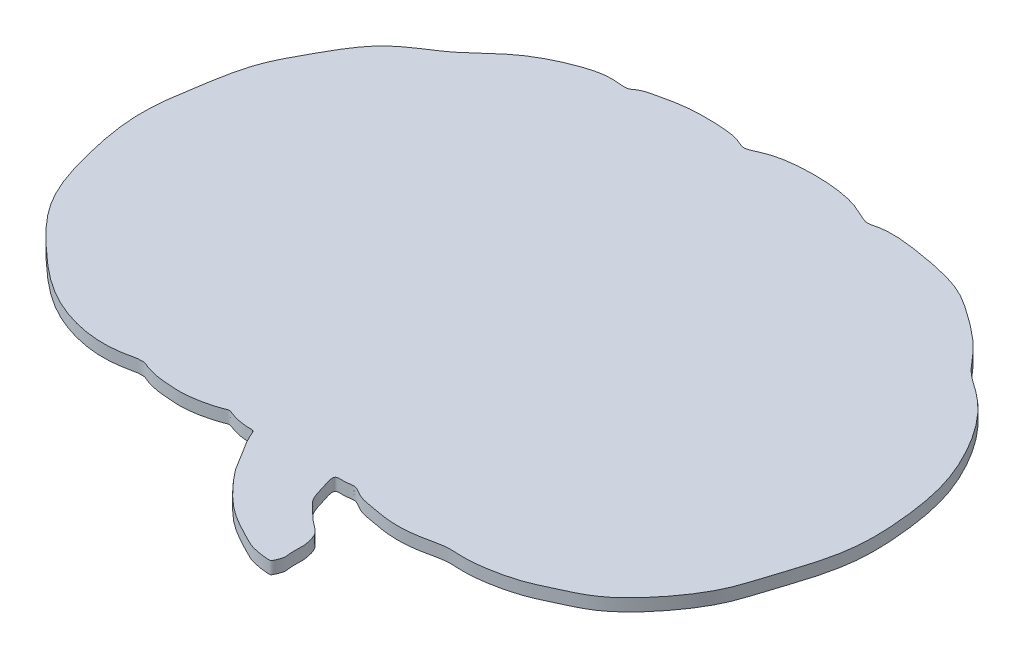
from build123d import *

# Parameters (mm, degrees)
SKETCH2_W           = 100
SKETCH2_H           = 100
BOSS_EXTRUDE1_DEPTH = 1.6
SKETCH3_OUTSIDE_W   = 130.286
SKETCH3_OUTSIDE_H   = 130.286
CUT_EXTRUDE1_DEPTH  = 1.6


with BuildPart() as part:
    # Sketch2 → Boss-Extrude1 (new body)
    with BuildSketch(Plane(origin=(0, 0, 0), x_dir=(1, 0, 0), z_dir=(0, 1, 0))):
        with Locations((-0.257731959, 18.943298969)):
            Rectangle(SKETCH2_W, SKETCH2_H)
    extrude(amount=-BOSS_EXTRUDE1_DEPTH)

    # Sketch3 outside → Cut-Extrude1 (cut)
    with BuildSketch(Plane(origin=(0, 0, 0), x_dir=(1, 0, 0), z_dir=(0, 1, 0))):
        with Locations((-0.258, 18.943)):
            Rectangle(SKETCH3_OUTSIDE_W, SKETCH3_OUTSIDE_H)
        with BuildLine():
            add(Edge.make_bspline(
                [(34.950997309, 45.362695625), (34.164831879, 46.178078321), (33.054937022, 47.967635676), (27.153917513, 52.406842473), (23.618279455, 54.24527127), (12.853472068, 56.049963087), (12.246934354, 54.364788685), (8.863222055, 56.557906971), (3.232160225, 57.229013924), (-2.157342772, 56.733671872), (-4.743426049, 55.034573484), (-5.812529736, 56.321241282), (-12.529283693, 56.565433617), (-14.901100597, 55.970851265), (-18.098005708, 55.302503425), (-18.610656154, 54.240448528), (-21.57387673, 55.146611767), (-27.301190872, 52.940548745), (-30.530434878, 50.832897231), (-33.852761058, 47.571927081), (-36.499264877, 45.839040885), (-40.287753693, 43.366865412), (-42.900938577, 38.608638109), (-45.937250479, 33.148799795), (-46.867439613, 27.220903425), (-48.046245103, 20.122367554), (-46.657550346, 12.471424796), (-44.156406564, 4.429669919), (-38.463388654, -1.289500535), (-31.892073125, -6.895358131), (-24.719390994, -8.610805623), (-20.544747565, -7.490478672), (-19.227418166, -7.446080787), (-19.270316446, -7.615797929), (-17.157434198, -8.249912673), (-14.515770266, -8.441024866), (-13.814628363, -8.49930702), (-11.848765158, -8.327082288), (-8.863747698, -7.583120649), (-8.63195569, -7.213031625), (-7.944967491, -7.552904389), (-7.227597251, -7.752341829), (-6.789606886, -7.880850065), (-5.268034144, -8.140151172), (-4.609625604, -7.88886944), (-4.29045862, -9.032726702), (-3.376811968, -10.544082426), (-2.660167345, -11.577393306), (-1.899268674, -13.208266223), (0.639121853, -16.221702105), (3.443338573, -18.766640075), (7.146851366, -20.620150121), (8.330947943, -21.330628058), (11.012209874, -21.626050336), (11.129229985, -21.457948699), (11.658160639, -20.27817926), (11.43720061, -19.551823763), (11.513454219, -17.906831656), (11.478056077, -17.508654259), (11.096070688, -15.48145802), (9.487267171, -14.592017914), (8.252373867, -13.257342574), (6.883291984, -12.159603408), (6.372702035, -10.491863326), (5.974551747, -9.363855541), (5.596278177, -7.850901786), (6.629517545, -7.890663318), (7.293566406, -7.878060994), (8.411562066, -7.613889334), (9.589380867, -8.653579819), (11.558799121, -8.915535728), (13.790322917, -9.408802563), (16.293471961, -9.465985035), (18.726890247, -9.082478047), (20.917712941, -8.511473013), (23.470944093, -8.77858095), (26.540958376, -8.394619581), (29.827797246, -7.604785039), (32.85115181, -6.118726522), (36.086084334, -4.702133218), (38.9006861, -2.173439828), (41.613648052, 1.152126904), (43.839095788, 4.723689829), (44.995395496, 8.784747337), (46.449572903, 12.985339864), (47.700686586, 18.16111214), (47.384180112, 24.444104281), (46.358082644, 30.669995162), (43.428316608, 37.129025351), (39.572142658, 42.257042456), (35.896545865, 44.382006445), (34.950997309, 45.362695625)],
                knots=[0, 0, 0, 0, 0.012581439, 0.021851406, 0.030192451, 0.03745538, 0.048803808, 0.056374421, 0.06415912, 0.072450955, 0.078983456, 0.085348182, 0.092327958, 0.100034412, 0.101849472, 0.110478557, 0.123680031, 0.143068749, 0.164045513, 0.177916208, 0.185937091, 0.20134871, 0.227824806, 0.246133936, 0.271974478, 0.295025885, 0.327362492, 0.359184618, 0.388613558, 0.416913063, 0.457724704, 0.463497906, 0.465472855, 0.471845881, 0.477112479, 0.480366301, 0.488424722, 0.493818067, 0.498708146, 0.507262607, 0.510940013, 0.513494469, 0.515545522, 0.518533956, 0.522910129, 0.528108255, 0.53218391, 0.537728085, 0.543638758, 0.560426517, 0.576701386, 0.589340543, 0.602104403, 0.605118156, 0.607694702, 0.61019699, 0.613016072, 0.616872562, 0.621645706, 0.628107162, 0.635128646, 0.642040022, 0.648735678, 0.654608597, 0.660605327, 0.664713641, 0.666968381, 0.67025072, 0.672851241, 0.679498598, 0.686578931, 0.695055102, 0.705493222, 0.714679809, 0.723006835, 0.730908159, 0.7434826, 0.757962921, 0.768984546, 0.781635939, 0.797818767, 0.811195178, 0.83041745, 0.844928745, 0.858875391, 0.880944319, 0.904719027, 0.929732105, 0.951984408, 0.984867865, 1, 1, 1, 1], degree=3))
        make_face(mode=Mode.SUBTRACT)
    extrude(amount=-CUT_EXTRUDE1_DEPTH, mode=Mode.SUBTRACT)


solid = part.part
